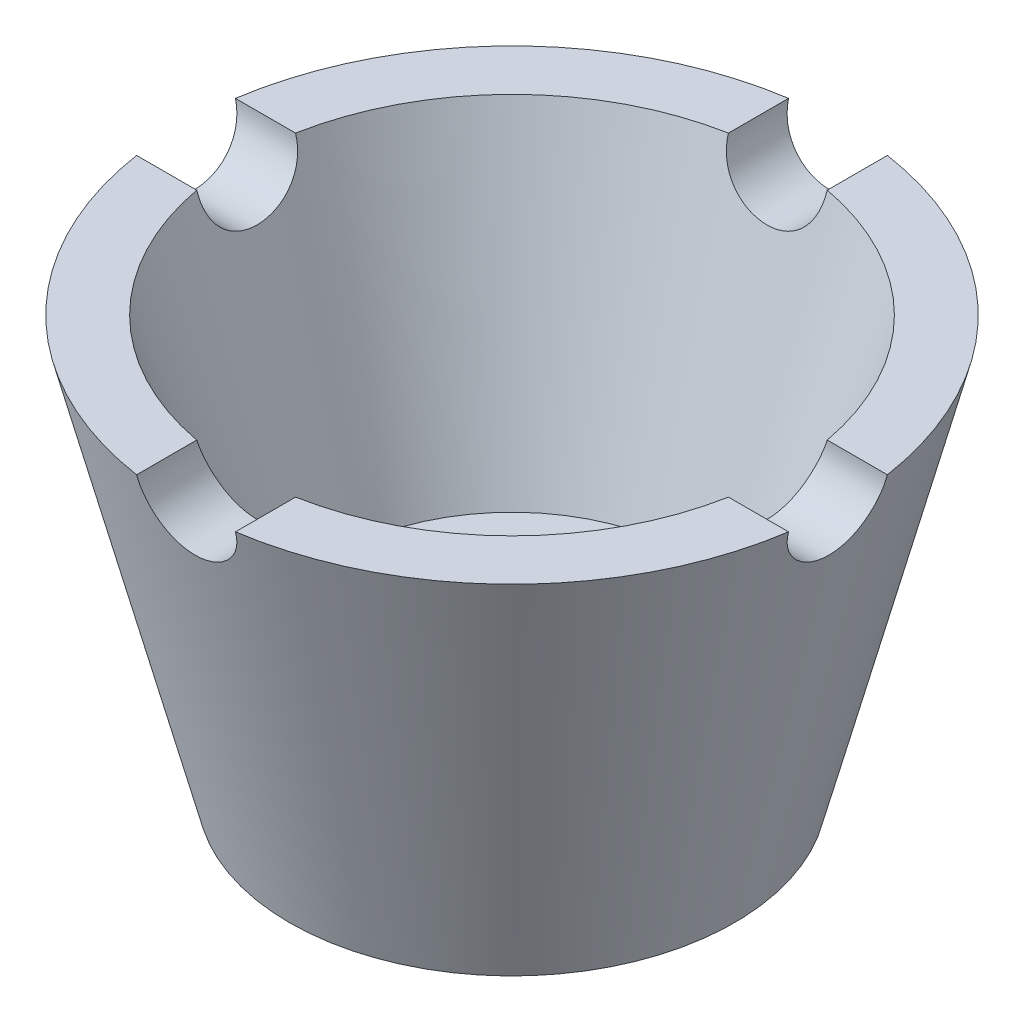
from build123d import *

# Parameters (mm, degrees)
CUT_EXTRUDE1_DEPTH      = 64.162373268
CUT_EXTRUDE1_DEPTH_BACK = 64.162373268
SKETCH2_R               = 5
CUT_EXTRUDE2_DEPTH      = 63.964159794
CUT_EXTRUDE2_DEPTH_BACK = 63.964159794
SKETCH3_R               = 5


with BuildPart() as part:
    # Sketch1 → Revolve1 (revolve)
    with BuildSketch(Plane.XY, mode=Mode.PRIVATE) as revolve1_sk:
        Polygon((11.25, 0), (11.25, 12), (18, 12), (27.357798165, 42), (33.357798165, 42), (22.5, 0), align=None)
    revolve(revolve1_sk.sketch.rotate(Axis((0, 40.458715596, 0), (0, -1, 0)), 90), axis=Axis((0, 40.458715596, 0), (0, -1, 0)))

    # Sketch2 → Cut-Extrude1 (cut, two sides: drawn at the far end of the back side and taken through both)
    with BuildSketch(Plane.XY.offset(-CUT_EXTRUDE1_DEPTH_BACK)):
        with Locations((0, 42)):
            Circle(SKETCH2_R)
    extrude(amount=CUT_EXTRUDE1_DEPTH + CUT_EXTRUDE1_DEPTH_BACK, mode=Mode.SUBTRACT)

    # Sketch3 → Cut-Extrude2 (cut, two sides: drawn at the far end of the back side and taken through both)
    with BuildSketch(Plane(origin=(0, 0, 0), x_dir=(0, 0, -1), z_dir=(1, 0, 0)).offset(-CUT_EXTRUDE2_DEPTH_BACK)):
        with Locations((0, 42)):
            Circle(SKETCH3_R)
    extrude(amount=CUT_EXTRUDE2_DEPTH + CUT_EXTRUDE2_DEPTH_BACK, mode=Mode.SUBTRACT)


solid = part.part
